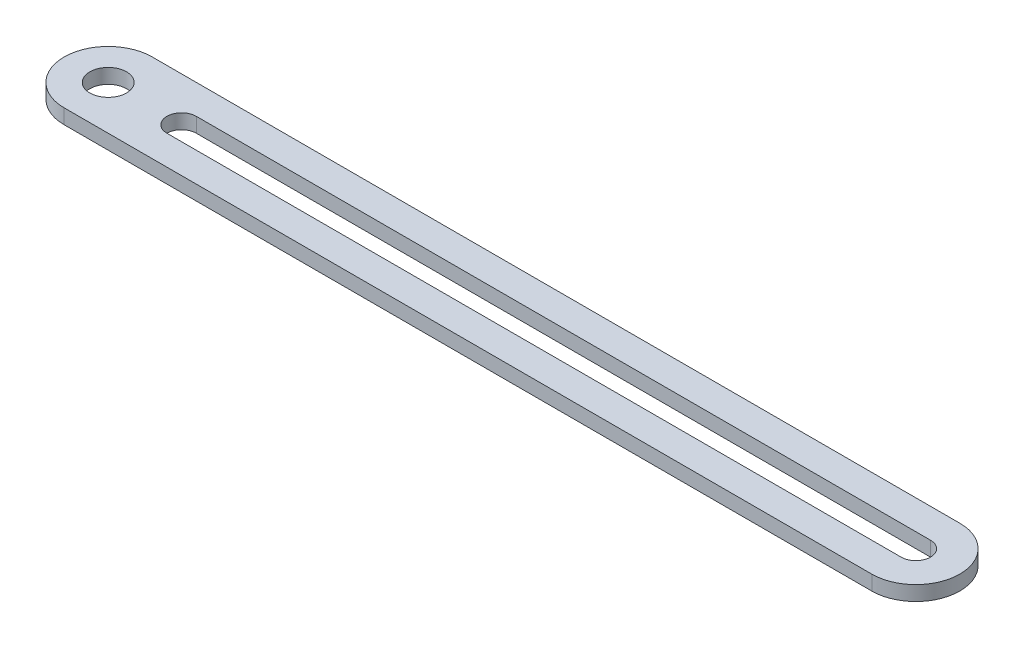
from build123d import *

# Parameters (mm, degrees)
SKETCH1_R           = 2.5
BOSS_EXTRUDE1_DEPTH = 2


with BuildPart() as part:
    # Sketch1 → Boss-Extrude1 (new body)
    with BuildSketch(Plane(origin=(0, 0, 0), x_dir=(1, 0, 0), z_dir=(0, 1, 0))):
        with BuildLine():
            Line((0, 6), (110, 6))
            ThreePointArc((110, 6), (116, 0), (110, -6))
            Line((110, -6), (0, -6))
            ThreePointArc((0, -6), (-6, 0), (0, 6))
        make_face()
        with Locations(Location((0, 0, 0), (0, 0, 270))):
            Circle(SKETCH1_R, mode=Mode.SUBTRACT)
        with BuildLine():
            Line((10, 2), (110, 2))
            ThreePointArc((110, 2), (112, 0), (110, -2))
            Line((110, -2), (10, -2))
            ThreePointArc((10, -2), (8, 0), (10, 2))
        make_face(mode=Mode.SUBTRACT)
    extrude(amount=BOSS_EXTRUDE1_DEPTH)


solid = part.part
